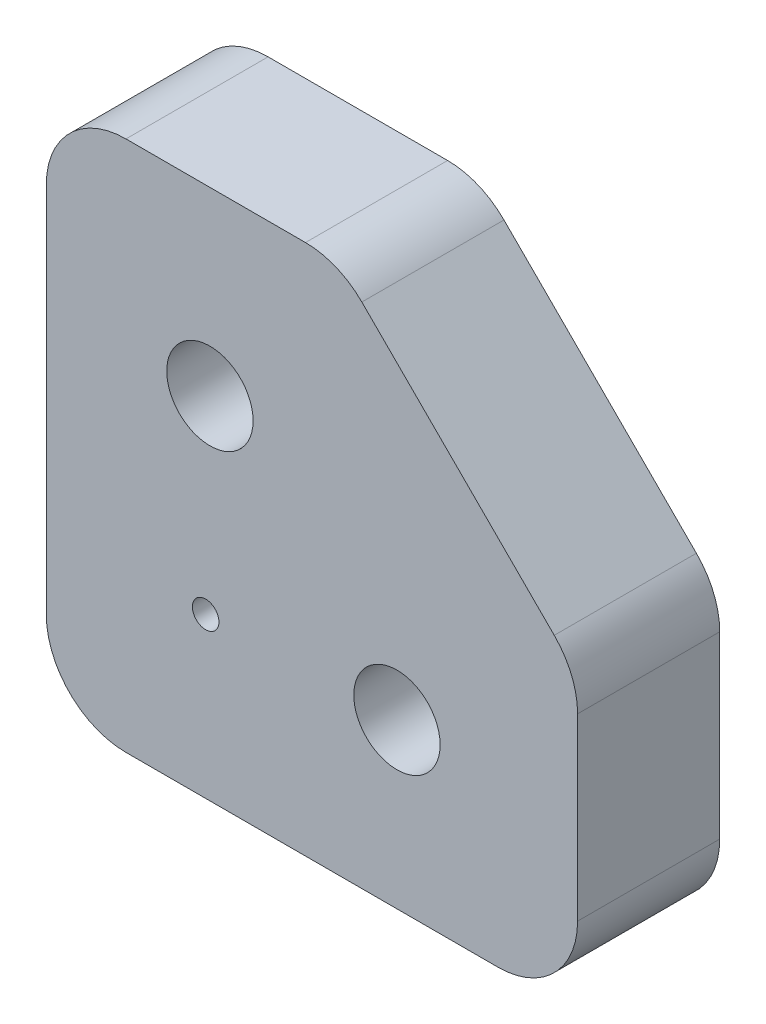
from build123d import *

# Parameters (mm, degrees)
MODEL_R             = 1.625
MODEL_R_2           = 0.5
BOSS_EXTRUDE1_DEPTH = 5.35


with BuildPart() as part:
    # Model → Boss-Extrude1 (new body)
    with BuildSketch(Plane.XY):
        with BuildLine():
            Line((0, 16.999999553), (0, 3.000000026))
            ThreePointArc((0, 3.000000026), (0.878679647, 0.878679666), (3, 0))
            Line((3, 0), (17.000000924, 0))
            ThreePointArc((17.000000924, 0), (19.121320381, 0.878680141), (19.999999553, 3))
            Line((19.999999553, 3), (19.999999553, 9.757359512))
            ThreePointArc((19.999999553, 9.757359512), (19.771638279, 10.905410171), (19.121319897, 11.878680528))
            Line((19.121319897, 11.878680528), (11.878679506, 19.121320918))
            ThreePointArc((11.878679506, 19.121320918), (10.905409814, 19.771638427), (9.757360185, 19.999999553))
            Line((9.757360185, 19.999999553), (3.000000026, 19.999999553))
            ThreePointArc((3.000000026, 19.999999553), (0.878679666, 19.121319906), (0, 16.999999553))
        make_face()
        with Locations((6.16, 13.2)):
            Circle(MODEL_R, mode=Mode.SUBTRACT)
        with Locations((13.2, 6.16)):
            Circle(MODEL_R, mode=Mode.SUBTRACT)
        with Locations((6, 6)):
            Circle(MODEL_R_2, mode=Mode.SUBTRACT)
    extrude(amount=BOSS_EXTRUDE1_DEPTH)


solid = part.part
